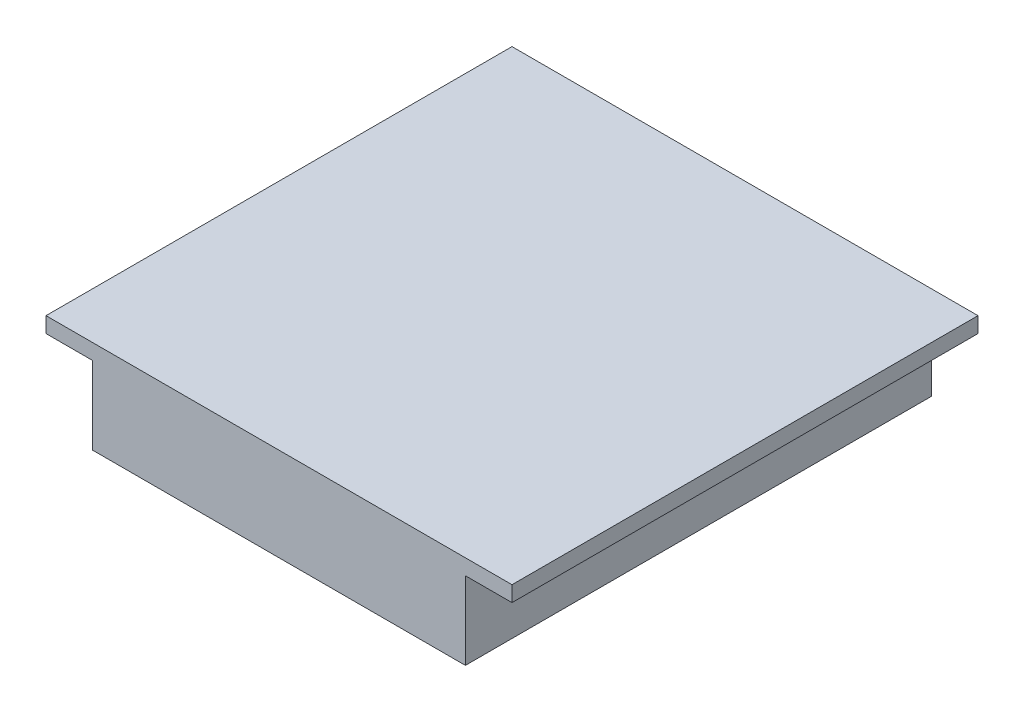
from build123d import *

# Parameters (mm, degrees)
BOSS_EXTRUDE1_DEPTH = 150


with BuildPart() as part:
    # Sketch1 → Boss-Extrude1 (new body)
    with BuildSketch(Plane.XY):
        Polygon((-59.582924894, 25), (-44.582924894, 25), (-44.582924894, 0), (75.417075106, 0), (75.417075106, 25), (90.417075106, 25), (90.417075106, 30), (-59.582924894, 30), align=None)
    extrude(amount=BOSS_EXTRUDE1_DEPTH)


solid = part.part
